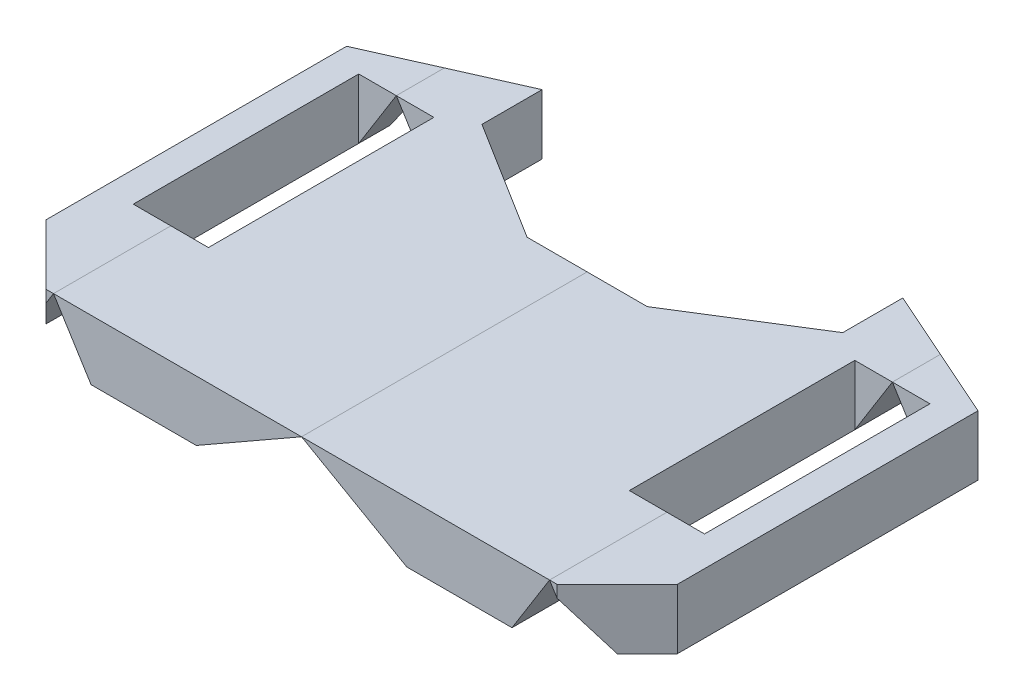
from build123d import *

# Parameters (mm, degrees)
SKETCH1_W           = 63.5
SKETCH1_H           = 190.5
BOSS_EXTRUDE1_DEPTH = 50.8
CUT_EXTRUDE1_DEPTH  = 708.805574494


with BuildPart() as part:
    # Sketch1 → Boss-Extrude1 (new body)
    with BuildSketch(Plane(origin=(0, 0, 0), x_dir=(1, 0, 0), z_dir=(0, 1, 0))):
        Polygon((446.699903074, -123.787447361), (345.099903074, -187.287447361), (243.499903074, -187.287447361), (141.899903074, -123.787447361), (141.899903074, -72.987447361), (27.599903074, -123.787447361), (27.599903074, -123.848308515), (27.599903074, -375.907017994), (27.599903074, -377.787447361), (78.399903074, -428.587447361), (510.199903074, -428.587447361), (560.999903074, -377.787447361), (560.999903074, -123.787447361), (446.699903074, -72.987447361), align=None)
        with Locations((84.749903074, -234.21600548)):
            Rectangle(SKETCH1_W, SKETCH1_H, mode=Mode.SUBTRACT)
        with Locations((503.849903074, -234.21600548)):
            Rectangle(SKETCH1_W, SKETCH1_H, mode=Mode.SUBTRACT)
    extrude(amount=-BOSS_EXTRUDE1_DEPTH)

    # Sketch2 → Cut-Extrude1 (cut, through all)
    with BuildSketch(Plane.XY):
        Polygon((52.999903074, -50.8), (84.749903074, 0), (116.499903074, -50.8), align=None)
        Polygon((294.299903074, 0), (205.399903074, -50.8), (383.199903074, -50.8), align=None)
        Polygon((472.099903074, -50.8), (535.599903074, -50.8), (503.849903074, 0), align=None)
    extrude(amount=CUT_EXTRUDE1_DEPTH, mode=Mode.SUBTRACT)


with BuildPart() as cut_extrude1_piece_1:
    # of the separate pieces the step leaves, piece 1, a body of its own (cut_extrude1_pieces)
    add(part.part.solids().sort_by_distance((116.499903074, 0, 329.46600548))[0])


with BuildPart() as cut_extrude1_piece_2:
    # of the separate pieces the step leaves, piece 2, a body of its own (cut_extrude1_pieces)
    add(part.part.solids().sort_by_distance((446.699903074, 0, 123.787447361))[0])


with BuildPart() as cut_extrude1_piece_3:
    # of the separate pieces the step leaves, piece 3, a body of its own (cut_extrude1_pieces)
    add(part.part.solids().sort_by_distance((560.999903074, 0, 123.787447361))[0])


with BuildPart() as cut_extrude1_piece_4:
    # of the separate pieces the step leaves, piece 4, a body of its own (cut_extrude1_pieces)
    add(part.part.solids().sort_by_distance((78.399903074, 0, 428.587447361))[0])


solid = Compound([cut_extrude1_piece_1.part, cut_extrude1_piece_2.part, cut_extrude1_piece_3.part, cut_extrude1_piece_4.part])
